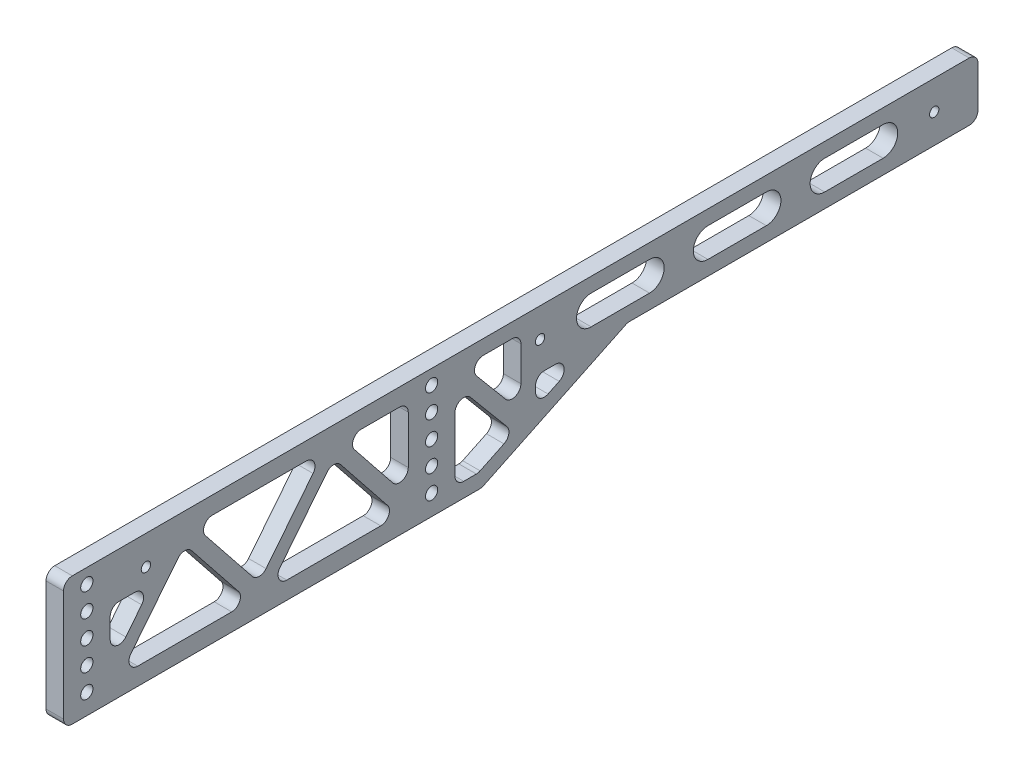
from build123d import *

# Parameters (mm, degrees)
SKETCH_1_R          = 1.6
SKETCH_1_R_2        = 2.1
EXTRUDE_1_DEPTH     = 6
CUT_EXTRUDE_1_DEPTH = 10
FILLET_1_R          = 3
FILLET_2_R          = 3


with BuildPart() as part:
    # 草图1 → 凸台-拉伸1 (new body)
    with BuildSketch(Plane(origin=(0, 0, 0), x_dir=(0, 0, -1), z_dir=(1, 0, 0))):
        Polygon((285, 10), (-28.22, 10), (-28.22, -34), (115, -34), (165, -10), (285, -10), align=None)
        Circle(SKETCH_1_R, mode=Mode.SUBTRACT)
        with Locations((135, 0)):
            Circle(SKETCH_1_R, mode=Mode.SUBTRACT)
        with Locations((270, 0)):
            Circle(SKETCH_1_R, mode=Mode.SUBTRACT)
        with Locations((97.86, -27)):
            Circle(SKETCH_1_R_2, mode=Mode.SUBTRACT)
        with Locations((97.86, -19)):
            Circle(SKETCH_1_R_2, mode=Mode.SUBTRACT)
        with Locations((97.86, -11)):
            Circle(SKETCH_1_R_2, mode=Mode.SUBTRACT)
        with Locations((97.86, -3)):
            Circle(SKETCH_1_R_2, mode=Mode.SUBTRACT)
        with Locations((97.86, 5)):
            Circle(SKETCH_1_R_2, mode=Mode.SUBTRACT)
        with Locations((-20.23, -27)):
            Circle(SKETCH_1_R_2, mode=Mode.SUBTRACT)
        with Locations((-20.23, -19)):
            Circle(SKETCH_1_R_2, mode=Mode.SUBTRACT)
        with Locations((-20.23, -11)):
            Circle(SKETCH_1_R_2, mode=Mode.SUBTRACT)
        with Locations((-20.23, -3)):
            Circle(SKETCH_1_R_2, mode=Mode.SUBTRACT)
        with Locations((-20.23, 5)):
            Circle(SKETCH_1_R_2, mode=Mode.SUBTRACT)
    extrude(amount=EXTRUDE_1_DEPTH)

    # 草图2 → 切除-拉伸1 (cut)
    with BuildSketch(Plane(origin=(6, 0, 0), x_dir=(0, 0, -1), z_dir=(1, 0, 0))):
        Polygon((13.2925, -0.009366832), (-9.032216719, -28), (35.617216719, -28), align=None)
        with BuildLine():
            ThreePointArc((3.290130805, -4.531560359), (1.729633197, -5.326196486), (0, -5.6))
            Line((0, -5.6), (-12.23, -5.6))
            Line((-12.23, -5.6), (-12.23, -23.990633168))
            Line((-12.23, -23.990633168), (3.290130805, -4.531560359))
        make_face()
        Polygon((61.139716719, 4), (16.490283281, 4), (38.815, -23.990633168), align=None)
        Polygon((64.3375, -0.009366832), (42.012783281, -28), (86.662216719, -28), align=None)
        Polygon((89.86, 4), (67.535283281, 4), (89.86, -23.990633168), align=None)
        Polygon((126.119901445, -23.116277457), (105.86, 1.103590865), (105.86, -29), (113.862146147, -29), align=None)
        Polygon((128.44547948, 5), (109.11934328, 5), (128.44547948, -18.103590865), align=None)
        Polygon((133.44547948, -19.6), (153.44547948, -10), (133.44547948, -10), align=None)
        with BuildLine():
            Line((152.5, -5), (172.5, -5))
            ThreePointArc((172.5, -5), (177.5, 0), (172.5, 5))
            Line((172.5, 5), (152.5, 5))
            ThreePointArc((152.5, 5), (147.5, 0), (152.5, -5))
        make_face()
        with BuildLine():
            Line((192.5, -5), (212.5, -5))
            ThreePointArc((212.5, -5), (217.5, 0), (212.5, 5))
            Line((212.5, 5), (192.5, 5))
            ThreePointArc((192.5, 5), (187.5, 0), (192.5, -5))
        make_face()
        with BuildLine():
            Line((232.5, -5), (252.5, -5))
            ThreePointArc((252.5, -5), (257.5, 0), (252.5, 5))
            Line((252.5, 5), (232.5, 5))
            ThreePointArc((232.5, 5), (227.5, 0), (232.5, -5))
        make_face()
    extrude(amount=-CUT_EXTRUDE_1_DEPTH, mode=Mode.SUBTRACT)

    # 圆角1
    fillet_1_edges = [part.edges().sort_by_distance(p)[0] for p in [
        (3, -23.116277457, -126.119901445),
        (3, -29, -113.862146147),
        (3, -29, -105.86),
        (3, 1.103590865, -105.86),
        (3, -18.103590865, -128.44547948),
        (3, 5, -109.11934328),
        (3, 5, -128.44547948),
        (3, 4, -61.139716719),
        (3, -23.990633168, -38.815),
        (3, -28, -86.662216719),
        (3, -28, -42.012783281),
        (3, -0.009366832, -64.3375),
        (3, -28, -35.617216719),
        (3, -28, 9.032216719),
        (3, -0.009366832, -13.2925),
        (3, 4, -89.86),
        (3, -23.990633168, -89.86),
        (3, 4, -67.535283281),
        (3, -4.531560359, -3.290130805),
        (3, -23.990633168, 12.23),
        (3, -5.6, 12.23),
        (3, -10, -133.44547948),
        (3, -10, -153.44547948),
        (3, -19.6, -133.44547948),
        (3, 4, -16.490283281),
    ]]
    fillet(fillet_1_edges, radius=FILLET_1_R)

    # 圆角2
    fillet_2_edges = [part.edges().sort_by_distance(p)[0] for p in [
        (3, -10, -285),
        (3, -10, -165),
        (3, -34, -115),
        (3, -34, 28.22),
        (3, 10, 28.22),
        (3, 10, -285),
    ]]
    fillet(fillet_2_edges, radius=FILLET_2_R)


solid = part.part
